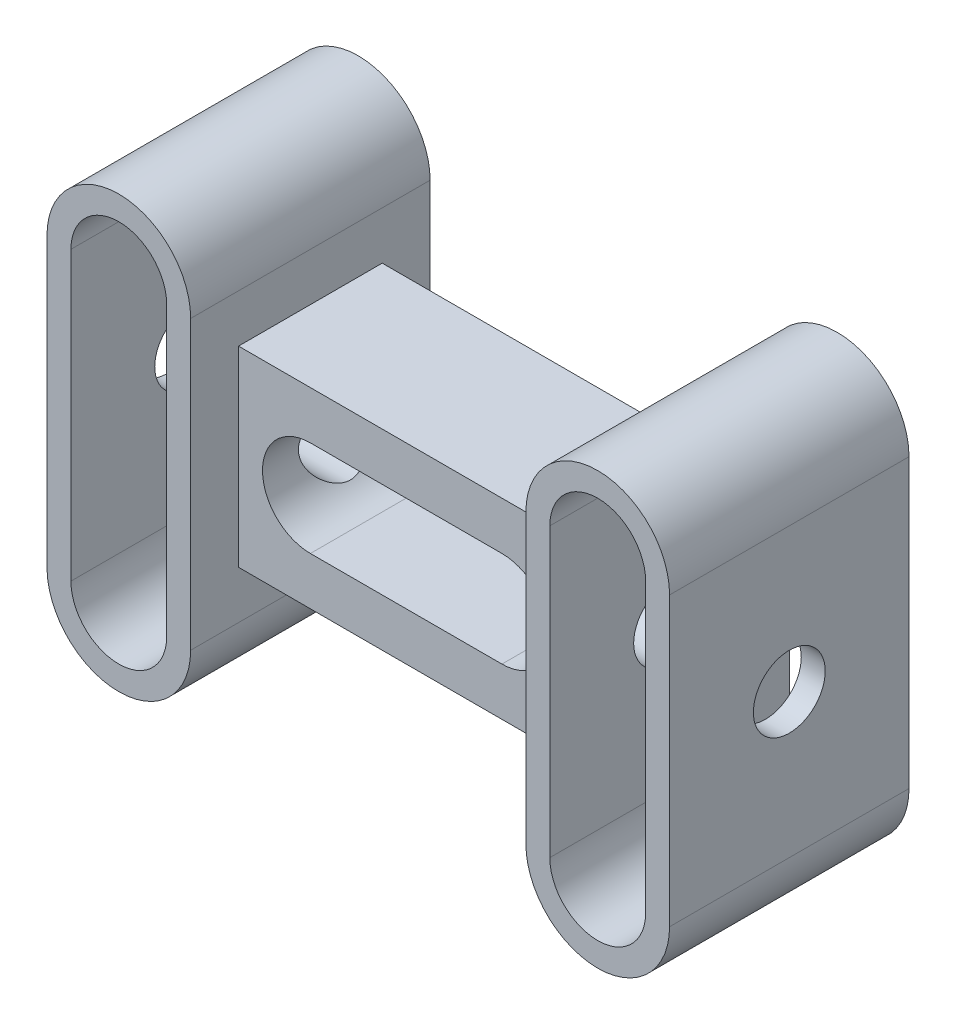
from build123d import *

# Parameters (mm, degrees)
BOSS_EXTRUDE1_DEPTH        = 25
BOSS_EXTRUDE1_DEPTH_BACK   = 25
BOSS_EXTRUDE1_2_DEPTH      = 25
BOSS_EXTRUDE1_2_DEPTH_BACK = 25
BOSS_EXTRUDE2_REACH        = 114.472
SKETCH3_W                  = 30
SKETCH3_H                  = 40
CUT_EXTRUDE1_DEPTH         = 89.600225733
HOLE1_D                    = 15


with BuildPart() as part:
    # Sketch1 → Boss-Extrude1 (new, two sides: drawn at the far end of the back side and taken through both)
    with BuildSketch(Plane.XY.offset(-BOSS_EXTRUDE1_DEPTH_BACK)):
        with BuildLine():
            Line((-35, 30), (-35, -30))
            ThreePointArc((-35, -30), (-50, -45), (-65, -30))
            Line((-65, -30), (-65, 30))
            ThreePointArc((-65, 30), (-50, 45), (-35, 30))
        make_face()
        with BuildLine():
            Line((-40, 30), (-40, -30))
            ThreePointArc((-40, -30), (-50, -40), (-60, -30))
            Line((-60, -30), (-60, 30))
            ThreePointArc((-60, 30), (-50, 40), (-40, 30))
        make_face(mode=Mode.SUBTRACT)
    extrude(amount=BOSS_EXTRUDE1_DEPTH + BOSS_EXTRUDE1_DEPTH_BACK)


with BuildPart() as body_2:
    # Sketch1 → Boss-Extrude1 2 (new, two sides: drawn at the far end of the back side and taken through both)
    with BuildSketch(Plane.XY.offset(-BOSS_EXTRUDE1_2_DEPTH_BACK)):
        with BuildLine():
            Line((35, 30), (35, -30))
            ThreePointArc((35, -30), (50, -45), (65, -30))
            Line((65, -30), (65, 30))
            ThreePointArc((65, 30), (50, 45), (35, 30))
        make_face()
        with BuildLine():
            Line((40, 30), (40, -30))
            ThreePointArc((40, -30), (50, -40), (60, -30))
            Line((60, -30), (60, 30))
            ThreePointArc((60, 30), (50, 40), (40, 30))
        make_face(mode=Mode.SUBTRACT)
    extrude(amount=BOSS_EXTRUDE1_2_DEPTH + BOSS_EXTRUDE1_2_DEPTH_BACK)

    # Sketch3 → Boss-Extrude2 (add, up to next)
    with BuildSketch(Plane(origin=(-35, 0, 0), x_dir=(0, 0, -1), z_dir=(1, 0, 0)), mode=Mode.PRIVATE) as boss_extrude2_sk1:
        Rectangle(SKETCH3_W, SKETCH3_H)
    boss_extrude2_tool1 = extrude(boss_extrude2_sk1.sketch, amount=BOSS_EXTRUDE2_REACH, mode=Mode.PRIVATE) - body_2.part

    add(part.part)  # Boss-Extrude2 merges part
    add(boss_extrude2_tool1.solids().sort_by_distance((-35, 0, 0))[0])

    # Sketch4 → Cut-Extrude1 (cut, through all)
    with BuildSketch(Plane(origin=(0, 0, -15), x_dir=(-1, 0, 0), z_dir=(0, 0, -1))):
        with BuildLine():
            Line((-20, 10), (20, 10))
            ThreePointArc((20, 10), (30, 0), (20, -10))
            Line((20, -10), (-20, -10))
            ThreePointArc((-20, -10), (-30, 0), (-20, 10))
        make_face()
    extrude(amount=-CUT_EXTRUDE1_DEPTH, mode=Mode.SUBTRACT)

    # Hole1 (through all)
    with Locations(Plane(origin=(65, 0, 0), x_dir=(0, 0, -1), z_dir=(1, 0, 0))):
        with Locations((0, 0)):
            Hole(HOLE1_D / 2)


solid = body_2.part
